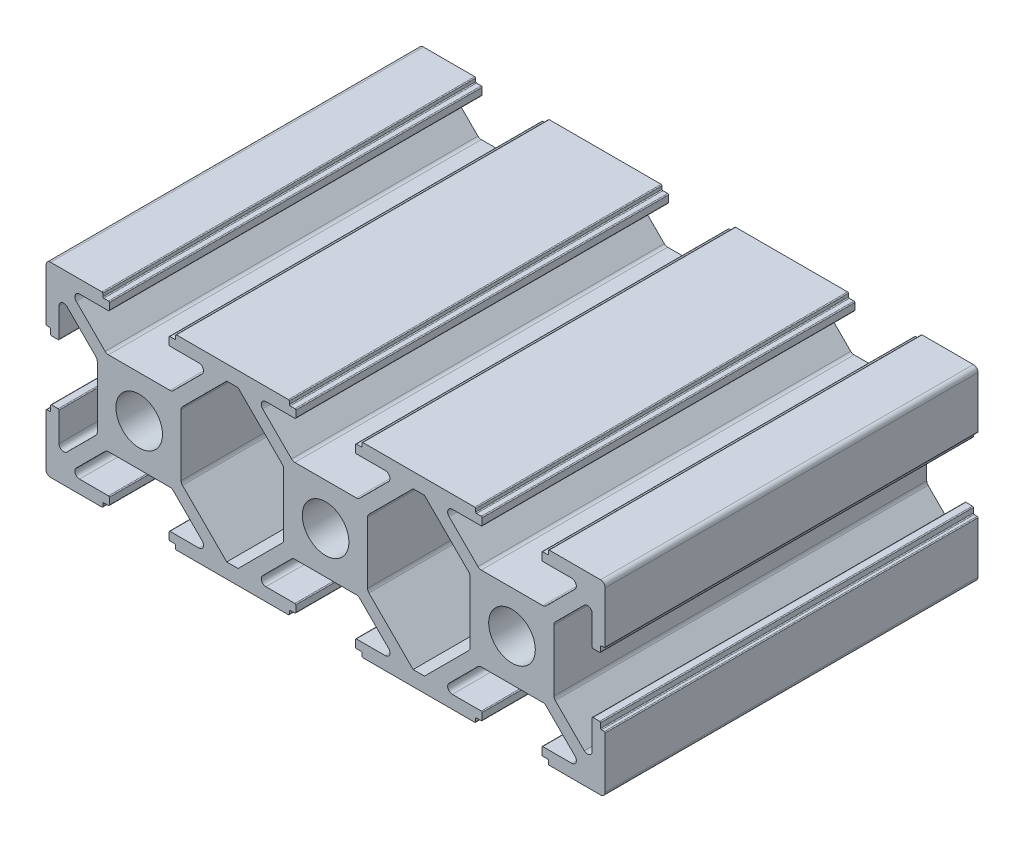
from build123d import *
from build123d.topology import SkipClean

# Parameters (mm, degrees)
Y_KSEKLIK_EKSTR_ZYON1_DEPTH = 40
Y_KSEKLIK_EKSTR_ZYON2_DEPTH = 40


with BuildPart() as part:
    # Çizim1 → Yükseklik-Ekstrüzyon1 (new body)
    with BuildSketch(Plane.XY):
        with BuildLine():
            Line((0, 2.5), (0, 4.5))
            Line((0, 4.5), (-3.302943725, 4.5))
            ThreePointArc((-3.302943725, 4.5), (-3.494285441, 4.538060234), (-3.656497116, 4.646446609))
            Line((-3.656497116, 4.646446609), (-6.756497116, 7.746446609))
            ThreePointArc((-6.756497116, 7.746446609), (-6.864883491, 8.291341716), (-6.402943725, 8.6))
            Line((-6.402943725, 8.6), (-3.3, 8.6))
            ThreePointArc((-3.3, 8.6), (-3.229289322, 8.629289322), (-3.2, 8.7))
            Line((-3.2, 8.7), (-3.2, 9.4))
            ThreePointArc((-3.2, 9.4), (-3.229289322, 9.470710678), (-3.3, 9.5))
            Line((-3.3, 9.5), (-3.8, 9.5))
            ThreePointArc((-3.8, 9.5), (-3.870710678, 9.529289322), (-3.9, 9.6))
            Line((-3.9, 9.6), (-3.9, 9.9))
            ThreePointArc((-3.9, 9.9), (-3.929289322, 9.970710678), (-4, 10))
            Line((-4, 10), (-10, 10))
            Line((-10, 10), (-10, 8.4))
            Line((-10, 8.4), (-9.389949494, 8.4))
            Line((-9.389949494, 8.4), (-4.646446609, 3.656497116))
            ThreePointArc((-4.646446609, 3.656497116), (-4.538060234, 3.494285441), (-4.5, 3.302943725))
            Line((-4.5, 3.302943725), (-4.5, -3.302943725))
            ThreePointArc((-4.5, -3.302943725), (-4.538060234, -3.494285441), (-4.646446609, -3.656497116))
            Line((-4.646446609, -3.656497116), (-9.389949494, -8.4))
            Line((-9.389949494, -8.4), (-10, -8.4))
            Line((-10, -8.4), (-10, -10))
            Line((-10, -10), (-4, -10))
            ThreePointArc((-4, -10), (-3.929289322, -9.970710678), (-3.9, -9.9))
            Line((-3.9, -9.9), (-3.9, -9.6))
            ThreePointArc((-3.9, -9.6), (-3.870710678, -9.529289322), (-3.8, -9.5))
            Line((-3.8, -9.5), (-3.3, -9.5))
            ThreePointArc((-3.3, -9.5), (-3.229289322, -9.470710678), (-3.2, -9.4))
            Line((-3.2, -9.4), (-3.2, -8.7))
            ThreePointArc((-3.2, -8.7), (-3.229289322, -8.629289322), (-3.3, -8.6))
            Line((-3.3, -8.6), (-6.402943725, -8.6))
            ThreePointArc((-6.402943725, -8.6), (-6.864883491, -8.291341716), (-6.756497116, -7.746446609))
            Line((-6.756497116, -7.746446609), (-3.656497116, -4.646446609))
            ThreePointArc((-3.656497116, -4.646446609), (-3.494285441, -4.538060234), (-3.302943725, -4.5))
            Line((-3.302943725, -4.5), (0, -4.5))
            Line((0, -4.5), (0, -2.5))
            ThreePointArc((0, -2.5), (-2.5, 0), (0, 2.5))
        make_face()
    y_kseklik_ekstr_zyon1 = extrude(amount=-Y_KSEKLIK_EKSTR_ZYON1_DEPTH)

    # Aynalama1: Yükseklik-Ekstrüzyon1 across plane
    add(y_kseklik_ekstr_zyon1.mirror(Plane(origin=(-10, 0, -40), x_dir=(0, 0, 1), z_dir=(1, 0, 0))))

    # Aynalama2: part across plane


with BuildPart() as part_1:
    with SkipClean():  # the faces are left unmerged after this step: merging them gives an invalid solid
        add(part.part)
        add(part.part.mirror(Plane(origin=(-20, 0, -40), x_dir=(0, 0, 1), z_dir=(-1, 0, 0))))

    # Çizim1<7> → Yükseklik-Ekstrüzyon2 (add)
    with SkipClean():  # the faces are left unmerged after this step: merging them gives an invalid solid
        with BuildSketch(Plane.XY):
            with BuildLine():
                ThreePointArc((0, 2.5), (2.5, 0), (0, -2.5))
                Line((0, -2.5), (0, -4.5))
                Line((0, -4.5), (3.302943725, -4.5))
                ThreePointArc((3.302943725, -4.5), (3.494285441, -4.538060234), (3.656497116, -4.646446609))
                Line((3.656497116, -4.646446609), (6.756497116, -7.746446609))
                ThreePointArc((6.756497116, -7.746446609), (6.864883491, -8.291341716), (6.402943725, -8.6))
                Line((6.402943725, -8.6), (3.3, -8.6))
                ThreePointArc((3.3, -8.6), (3.229289322, -8.629289322), (3.2, -8.7))
                Line((3.2, -8.7), (3.2, -9.4))
                ThreePointArc((3.2, -9.4), (3.229289322, -9.470710678), (3.3, -9.5))
                Line((3.3, -9.5), (3.8, -9.5))
                ThreePointArc((3.8, -9.5), (3.870710678, -9.529289322), (3.9, -9.6))
                Line((3.9, -9.6), (3.9, -9.9))
                ThreePointArc((3.9, -9.9), (3.929289322, -9.970710678), (4, -10))
                Line((4, -10), (9.5, -10))
                ThreePointArc((9.5, -10), (9.853553391, -9.853553391), (10, -9.5))
                Line((10, -9.5), (10, -4))
                ThreePointArc((10, -4), (9.970710678, -3.929289322), (9.9, -3.9))
                Line((9.9, -3.9), (9.6, -3.9))
                ThreePointArc((9.6, -3.9), (9.529289322, -3.870710678), (9.5, -3.8))
                Line((9.5, -3.8), (9.5, -3.3))
                ThreePointArc((9.5, -3.3), (9.470710678, -3.229289322), (9.4, -3.2))
                Line((9.4, -3.2), (8.7, -3.2))
                ThreePointArc((8.7, -3.2), (8.629289322, -3.229289322), (8.6, -3.3))
                Line((8.6, -3.3), (8.6, -6.402943725))
                ThreePointArc((8.6, -6.402943725), (8.291341716, -6.864883491), (7.746446609, -6.756497116))
                Line((7.746446609, -6.756497116), (4.646446609, -3.656497116))
                ThreePointArc((4.646446609, -3.656497116), (4.538060234, -3.494285441), (4.5, -3.302943725))
                Line((4.5, -3.302943725), (4.5, 3.302943725))
                ThreePointArc((4.5, 3.302943725), (4.538060234, 3.494285441), (4.646446609, 3.656497116))
                Line((4.646446609, 3.656497116), (7.746446609, 6.756497116))
                ThreePointArc((7.746446609, 6.756497116), (8.291341716, 6.864883491), (8.6, 6.402943725))
                Line((8.6, 6.402943725), (8.6, 3.3))
                ThreePointArc((8.6, 3.3), (8.629289322, 3.229289322), (8.7, 3.2))
                Line((8.7, 3.2), (9.4, 3.2))
                ThreePointArc((9.4, 3.2), (9.470710678, 3.229289322), (9.5, 3.3))
                Line((9.5, 3.3), (9.5, 3.8))
                ThreePointArc((9.5, 3.8), (9.529289322, 3.870710678), (9.6, 3.9))
                Line((9.6, 3.9), (9.9, 3.9))
                ThreePointArc((9.9, 3.9), (9.970710678, 3.929289322), (10, 4))
                Line((10, 4), (10, 9.5))
                ThreePointArc((10, 9.5), (9.853553391, 9.853553391), (9.5, 10))
                Line((9.5, 10), (4, 10))
                ThreePointArc((4, 10), (3.929289322, 9.970710678), (3.9, 9.9))
                Line((3.9, 9.9), (3.9, 9.6))
                ThreePointArc((3.9, 9.6), (3.870710678, 9.529289322), (3.8, 9.5))
                Line((3.8, 9.5), (3.3, 9.5))
                ThreePointArc((3.3, 9.5), (3.229289322, 9.470710678), (3.2, 9.4))
                Line((3.2, 9.4), (3.2, 8.7))
                ThreePointArc((3.2, 8.7), (3.229289322, 8.629289322), (3.3, 8.6))
                Line((3.3, 8.6), (6.402943725, 8.6))
                ThreePointArc((6.402943725, 8.6), (6.864883491, 8.291341716), (6.756497116, 7.746446609))
                Line((6.756497116, 7.746446609), (3.656497116, 4.646446609))
                ThreePointArc((3.656497116, 4.646446609), (3.494285441, 4.538060234), (3.302943725, 4.5))
                Line((3.302943725, 4.5), (0, 4.5))
                Line((0, 4.5), (0, 2.5))
            make_face()
        y_kseklik_ekstr_zyon2 = extrude(amount=-Y_KSEKLIK_EKSTR_ZYON2_DEPTH)

    # Aynalama3: Yükseklik-Ekstrüzyon2 across plane
    with SkipClean():  # the faces are left unmerged after this step: merging them gives an invalid solid
        add(y_kseklik_ekstr_zyon2.mirror(Plane(origin=(-20, 0, 0), x_dir=(0, 0, 1), z_dir=(1, 0, 0))))


solid = part_1.part
